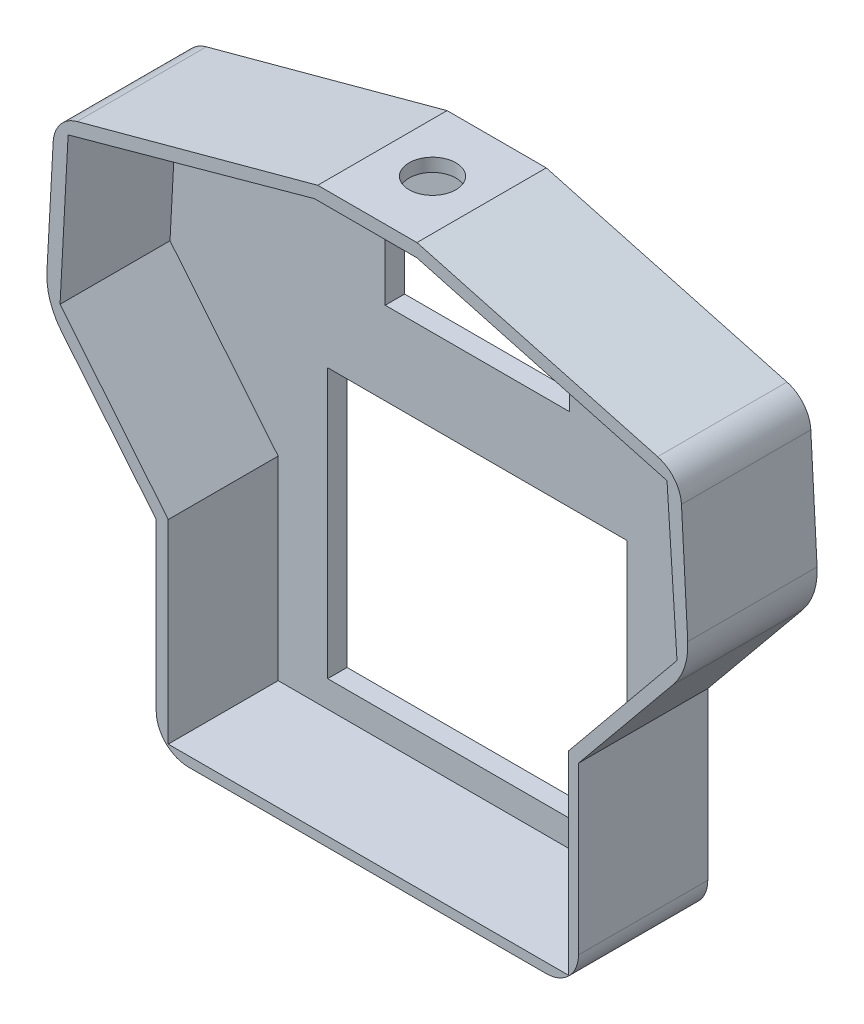
from build123d import *

# Parameters (mm, degrees)
BOSS_EXTRUDE1_DEPTH     = 40
CUT_EXTRUDE1_DEPTH      = 2
CUT_EXTRUDE1_DEPTH_BACK = 34
SKETCH5_R               = 7.241016292
CUT_EXTRUDE2_DEPTH      = 19
SKETCH4_W               = 56.944481184
SKETCH4_H               = 24.913210518
SKETCH4_W_2             = 92.534781926
SKETCH4_H_2             = 83.281303733
CUT_EXTRUDE3_DEPTH      = 19
FILLET1_R               = 10
FILLET2_R               = 10
FILLET5_R               = 20
FILLET6_R               = 20
FILLET11_R              = 10
FILLET12_R              = 10


with BuildPart() as part:
    # Sketch1 → Boss-Extrude1 (new body)
    with BuildSketch(Plane.XY):
        Polygon((-15.339960816, 87.909775446), (15.339960816, 87.909775446), (96.75975284, 65.883165043), (99.51307914, 15.143294652), (65.29316655, -26.549932182), (65.29316655, -87.909775446), (-65.29316655, -87.909775446), (-65.29316655, -26.549932182), (-99.51307914, 15.143294652), (-96.75975284, 65.883165043), align=None)
    extrude(amount=BOSS_EXTRUDE1_DEPTH)

    # Sketch3 → Cut-Extrude1 (cut, two sides: drawn at the far end of the back side and taken through both)
    with BuildSketch(Plane.XY.offset(40).offset(-CUT_EXTRUDE1_DEPTH_BACK)):
        Polygon((-92.534781925, 62.816880807), (-16.371538341, 83.815158244), (15.303829318, 83.815158244), (92.673798797, 62.816880807), (95.770608339, 16.193586837), (62.268759659, -24.735259015), (62.268759659, -84.882867266), (60.147608251, -84.882867266), (-61.571220281, -84.882867266), (-61.571220281, -24.735259015), (-95.026102977, 16.193586837), align=None)
    extrude(amount=CUT_EXTRUDE1_DEPTH + CUT_EXTRUDE1_DEPTH_BACK, mode=Mode.SUBTRACT)

    # Sketch5 → Cut-Extrude2 (cut)
    with BuildSketch(Plane(origin=(0, 87.909775446, 0), x_dir=(1, 0, 0), z_dir=(0, 1, 0))):
        with Locations(Location((0, -19.844342197, 0), (0, 0, 270))):
            Circle(SKETCH5_R)
    extrude(amount=-CUT_EXTRUDE2_DEPTH, mode=Mode.SUBTRACT)

    # Sketch4 → Cut-Extrude3 (cut)
    with BuildSketch(Plane.XY.offset(6)):
        with Locations((0, 44.665827429)):
            Rectangle(SKETCH4_W, SKETCH4_H)
        with Locations((0, -35.05644623)):
            Rectangle(SKETCH4_W_2, SKETCH4_H_2)
    extrude(amount=-CUT_EXTRUDE3_DEPTH, mode=Mode.SUBTRACT)

    # Fillet1
    fillet1_edges = [part.edges().sort_by_distance(p)[0] for p in [
        (96.75975284, 65.883165043, 20),
    ]]
    fillet(fillet1_edges, radius=FILLET1_R)

    # Fillet2
    fillet2_edges = [part.edges().sort_by_distance(p)[0] for p in [
        (-96.75975284, 65.883165043, 20),
    ]]
    fillet(fillet2_edges, radius=FILLET2_R)

    # Fillet5
    fillet5_edges = [part.edges().sort_by_distance(p)[0] for p in [
        (-99.51307914, 15.143294652, 20),
    ]]
    fillet(fillet5_edges, radius=FILLET5_R)

    # Fillet6
    fillet6_edges = [part.edges().sort_by_distance(p)[0] for p in [
        (99.51307914, 15.143294652, 20),
    ]]
    fillet(fillet6_edges, radius=FILLET6_R)

    # Fillet11
    fillet11_edges = [part.edges().sort_by_distance(p)[0] for p in [
        (65.29316655, -87.909775446, 20),
    ]]
    fillet(fillet11_edges, radius=FILLET11_R)

    # Fillet12
    fillet12_edges = [part.edges().sort_by_distance(p)[0] for p in [
        (-65.29316655, -87.909775446, 20),
    ]]
    fillet(fillet12_edges, radius=FILLET12_R)


solid = part.part
